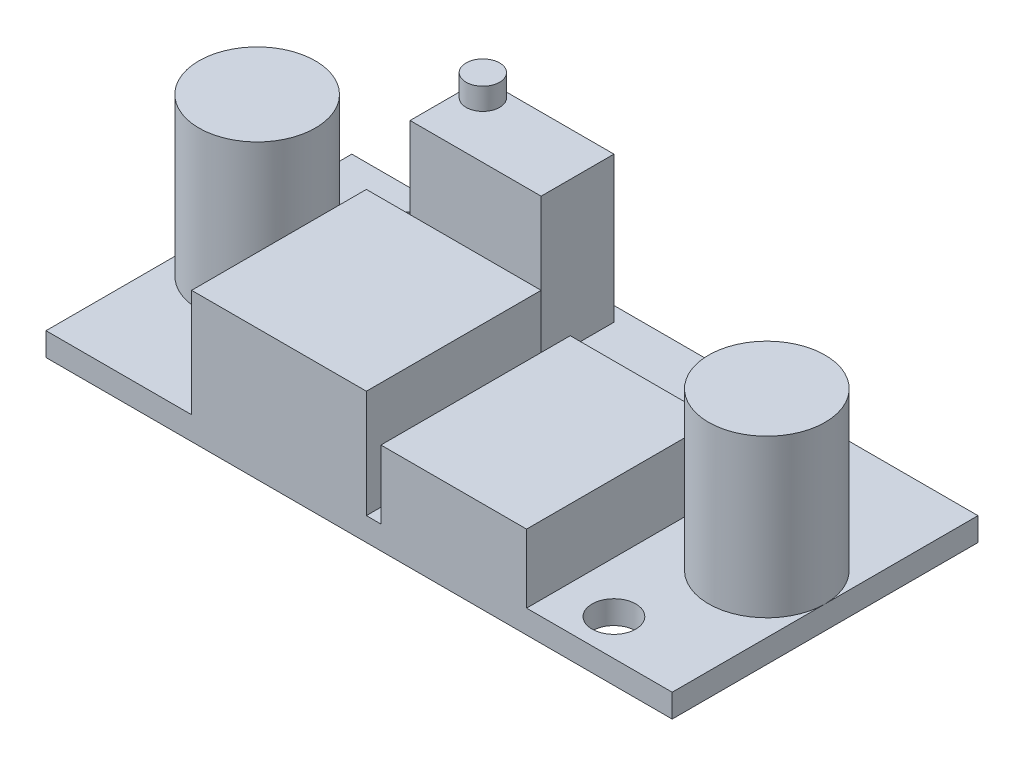
from build123d import *

# Parameters (mm, degrees)
SKETCH_1_W          = 43
SKETCH_1_H          = 21
EXTRUDE_1_DEPTH     = 1.6
SKETCH_2_R          = 1.5
CUT_EXTRUDE_1_DEPTH = 24.98040867
SKETCH_2_3_R        = 4
EXTRUDE_2_DEPTH     = 10.8
SKETCH_2_4_W        = 12
SKETCH_2_4_H        = 12
EXTRUDE_3_DEPTH     = 7.4
SKETCH_2_5_W        = 10
SKETCH_2_5_H        = 13
EXTRUDE_4_DEPTH     = 4.7
SKETCH_2_6_W        = 9
SKETCH_2_6_H        = 5
EXTRUDE_5_DEPTH     = 10
SKETCH_3_R          = 1.15
EXTRUDE_6_DEPTH     = 1.5


with BuildPart() as part:
    # Эскиз1 → Бобышка-Вытянуть1 (new body)
    with BuildSketch(Plane(origin=(0, 0, 0), x_dir=(1, 0, 0), z_dir=(0, 1, 0))):
        Rectangle(SKETCH_1_W, SKETCH_1_H)
    extrude(amount=EXTRUDE_1_DEPTH)

    # Эскиз2 → Вырез-Вытянуть1 (cut, through all)
    with BuildSketch(Plane(origin=(0, 1.6, 0), x_dir=(1, 0, 0), z_dir=(0, 1, 0))):
        with Locations((-15, 8)):
            Circle(SKETCH_2_R)
        with Locations((15, -8)):
            Circle(SKETCH_2_R)
    extrude(amount=-CUT_EXTRUDE_1_DEPTH, mode=Mode.SUBTRACT)

    # Эскиз2<3> → Бобышка-Вытянуть2 (add)
    with BuildSketch(Plane(origin=(0, 1.6, 0), x_dir=(1, 0, 0), z_dir=(0, 1, 0))):
        with Locations((-17.5, 0)):
            Circle(SKETCH_2_3_R)
        with Locations((17.5, 0)):
            Circle(SKETCH_2_3_R)
    extrude(amount=EXTRUDE_2_DEPTH)

    # Эскиз2<4> → Бобышка-Вытянуть3 (add)
    with BuildSketch(Plane(origin=(0, 1.6, 0), x_dir=(1, 0, 0), z_dir=(0, 1, 0))):
        with Locations((-5.5, -4.5)):
            Rectangle(SKETCH_2_4_W, SKETCH_2_4_H)
    extrude(amount=EXTRUDE_3_DEPTH)

    # Эскиз2<5> → Бобышка-Вытянуть4 (add)
    with BuildSketch(Plane(origin=(0, 1.6, 0), x_dir=(1, 0, 0), z_dir=(0, 1, 0))):
        with Locations((6.5, -4)):
            Rectangle(SKETCH_2_5_W, SKETCH_2_5_H)
    extrude(amount=EXTRUDE_4_DEPTH)

    # Эскиз2<6> → Бобышка-Вытянуть5 (add)
    with BuildSketch(Plane(origin=(0, 1.6, 0), x_dir=(1, 0, 0), z_dir=(0, 1, 0))):
        with Locations((-7, 7)):
            Rectangle(SKETCH_2_6_W, SKETCH_2_6_H)
    extrude(amount=EXTRUDE_5_DEPTH)

    # Эскиз3 → Бобышка-Вытянуть6 (add)
    with BuildSketch(Plane(origin=(0, 11.6, 0), x_dir=(1, 0, 0), z_dir=(0, 1, 0))):
        with Locations((-10.35, 8.35)):
            Circle(SKETCH_3_R)
    extrude(amount=EXTRUDE_6_DEPTH)


solid = part.part
